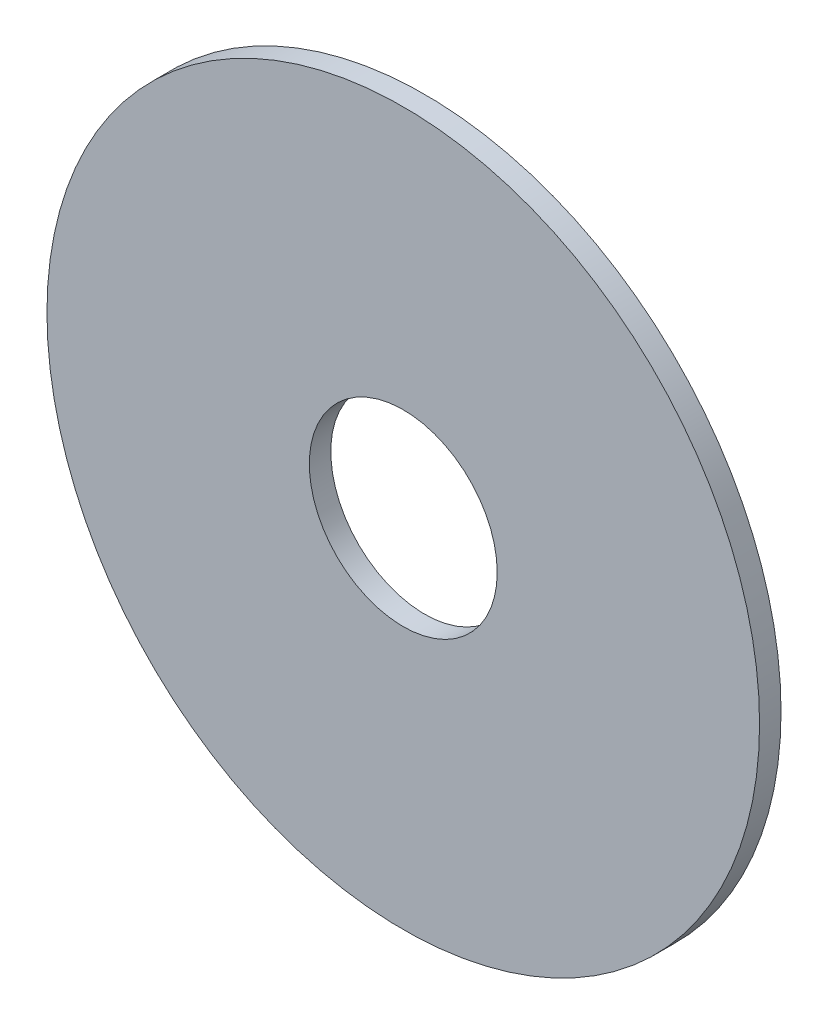
from build123d import *

# Parameters (mm, degrees)
SKETCH1_R           = 66.37
SKETCH1_R_2         = 17.5
BOSS_EXTRUDE1_DEPTH = 4


with BuildPart() as part:
    # Sketch1 → Boss-Extrude1 (new body)
    with BuildSketch(Plane(origin=(0, 0, 0), x_dir=(-1, 0, 0), z_dir=(0, 0, 1))):
        with Locations(Location((-4.254529608, -4.596847537, 0), (0, 0, 180))):
            Circle(SKETCH1_R)
        with Locations(Location((-4.254529608, -4.596847537, 0), (0, 0, 180))):
            Circle(SKETCH1_R_2, mode=Mode.SUBTRACT)
    extrude(amount=BOSS_EXTRUDE1_DEPTH)


solid = part.part
